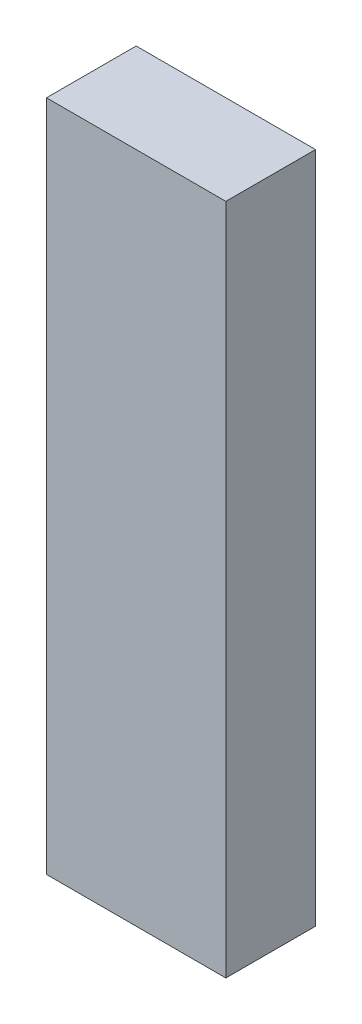
from build123d import *

# Parameters (mm, degrees)
SKETCH1_W           = 25.4
SKETCH1_H           = 12.7
BOSS_EXTRUDE1_DEPTH = 95.25
SKETCH2_R           = 3.175
CUT_EXTRUDE1_DEPTH  = 25.4


with BuildPart() as part:
    # Sketch1 → Boss-Extrude1 (new body)
    with BuildSketch(Plane(origin=(0, 0, 0), x_dir=(1, 0, 0), z_dir=(0, 1, 0))):
        with Locations((12.7, 6.35)):
            Rectangle(SKETCH1_W, SKETCH1_H)
    extrude(amount=BOSS_EXTRUDE1_DEPTH)

    # Sketch2 → Cut-Extrude1 (cut)
    with BuildSketch(Plane.XZ):
        with Locations(Location((6.35, -6.35, 0), (0, 0, 270))):
            Circle(SKETCH2_R)
        with Locations(Location((19.05, -6.35, 0), (0, 0, 270))):
            Circle(SKETCH2_R)
    extrude(amount=-CUT_EXTRUDE1_DEPTH, mode=Mode.SUBTRACT)


solid = part.part
